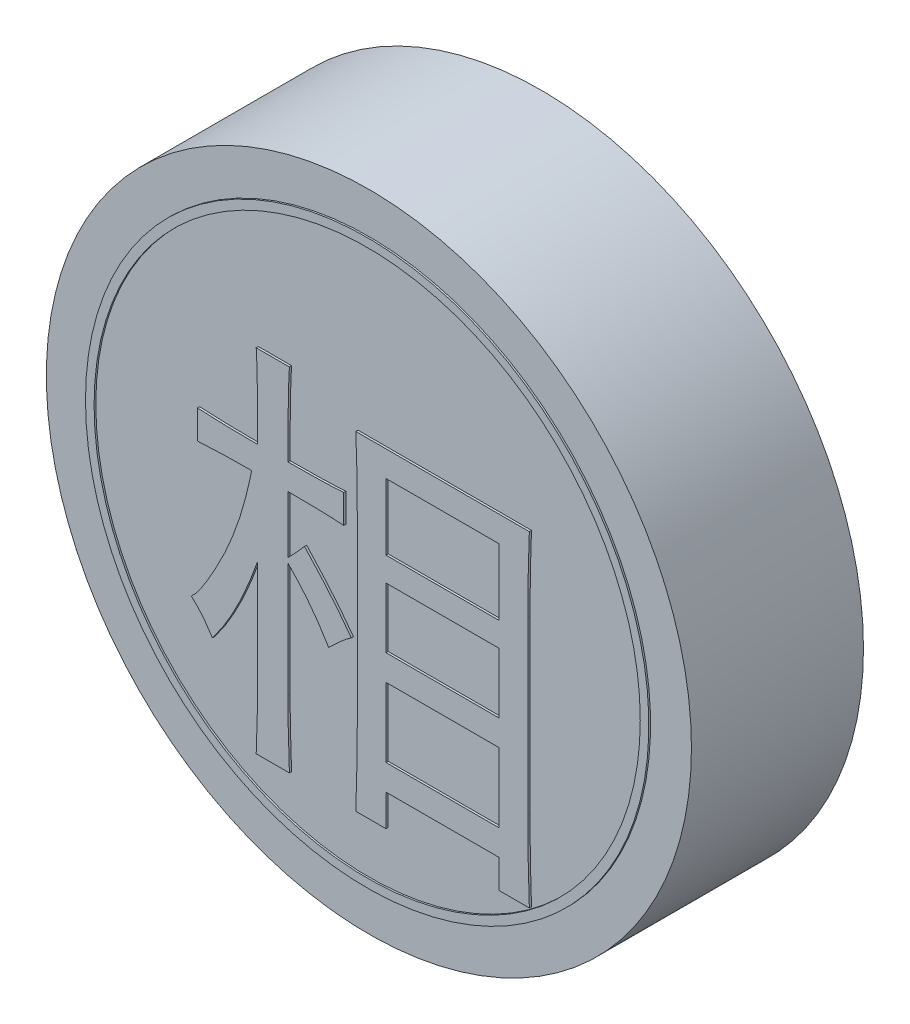
from build123d import *

# Parameters (mm, degrees)
SKETCH_1_R               = 15
DIAMETER30_HEIGHT8_DEPTH = 8
SKETCH_2_W               = 5.263157895
SKETCH_2_H               = 3.228070175
SKETCH_2_H_2             = 3.087719298
SKETCH_2_H_3             = 2.807017544
CHARACTER_DEPTH          = 0.1
SKETCH_3_R               = 13.1
SKETCH_3_R_2             = 12.7
INK_RING_DEPTH           = 0.08


with BuildPart() as part:
    # 草图1 → Diameter30_Height8 (new body)
    with BuildSketch(Plane.XY):
        Circle(SKETCH_1_R)
    extrude(amount=-DIAMETER30_HEIGHT8_DEPTH)

    # 草图2 → Character_相 (add)
    # profile 1 of 2: a face of its own
    with BuildSketch(Plane.XY):
        with BuildLine():
            add(Edge.make_bspline(
                [(7.561403509, 5.043859649), (7.55019112, 4.760584697), (7.527530744, 4.188082503), (7.508340227, 3.319863454), (7.49462205, 2.433550242), (7.492367, 1.83658782), (7.49122807, 1.535087719)],
                knots=[0, 0, 0, 0, 0.969283805, 1.958934606, 2.969145462, 4, 4, 4, 4], degree=3))
            Line((7.49122807, 1.535087719), (7.49122807, -6.394736842))
            add(Edge.make_bspline(
                [(7.49122807, -6.394736842), (7.494373274, -7.020306568), (7.500608133, -8.260397781), (7.541259106, -9.499836795), (7.561403509, -10.114035088)],
                knots=[0, 0, 0, 0, 1.008909215, 2, 2, 2, 2], degree=3))
            Line((7.561403509, -10.114035088), (6.157894737, -10.114035088))
            Line((6.157894737, -10.114035088), (6.157894737, -8.780701754))
            Line((6.157894737, -8.780701754), (0.894736842, -8.780701754))
            Line((0.894736842, -8.780701754), (0.894736842, -10.254385965))
            Line((0.894736842, -10.254385965), (-0.50877193, -10.254385965))
            add(Edge.make_bspline(
                [(-0.50877193, -10.254385965), (-0.497692205, -9.914790058), (-0.476326497, -9.259926631), (-0.456441705, -8.312053821), (-0.44245572, -7.435279895), (-0.439845263, -6.873840554), (-0.438596491, -6.605263158)],
                knots=[0, 0, 0, 0, 1.117081682, 2.154136505, 3.116988825, 4, 4, 4, 4], degree=3))
            Line((-0.438596491, -6.605263158), (-0.438596491, 1.605263158))
            add(Edge.make_bspline(
                [(-0.438596491, 1.605263158), (-0.439728026, 1.905030661), (-0.441958496, 2.495929231), (-0.45560045, 3.368382891), (-0.474798879, 4.214949159), (-0.497552487, 4.770115799), (-0.50877193, 5.043859649)],
                knots=[0, 0, 0, 0, 1.04583296, 2.06153501, 3.044173712, 4, 4, 4, 4], degree=3))
            Line((-0.50877193, 5.043859649), (7.561403509, 5.043859649))
        make_face()
        with Locations((3.52631579, -5.973684211)):
            Rectangle(SKETCH_2_W, SKETCH_2_H, mode=Mode.SUBTRACT)
        with Locations((3.52631579, 2.307017544)):
            Rectangle(SKETCH_2_W, SKETCH_2_H_2, mode=Mode.SUBTRACT)
        with Locations((3.52631579, -1.763157895)):
            Rectangle(SKETCH_2_W, SKETCH_2_H_3, mode=Mode.SUBTRACT)
    # profile 2 of 2: a face of its own
    with BuildSketch(Plane.XY):
        with BuildLine():
            add(Edge.make_bspline(
                [(-5.070175439, 2.236842105), (-5.069643134, 2.466430588), (-5.068622699, 2.906554508), (-5.075570455, 3.53725376), (-5.079714917, 4.10907054), (-5.087055031, 4.62111986), (-5.098673186, 5.0733128), (-5.106736303, 5.466792434), (-5.12325681, 5.801143721), (-5.135036136, 6.004664303), (-5.140350877, 6.096491228)],
                knots=[0, 0, 0, 0, 1.427178642, 2.735918853, 3.920795363, 4.981877593, 5.919216055, 6.732723881, 7.428214742, 8, 8, 8, 8], degree=3))
            Line((-5.140350877, 6.096491228), (-3.596491228, 6.096491228))
            add(Edge.make_bspline(
                [(-3.596491228, 6.096491228), (-3.601779492, 5.999464476), (-3.613344956, 5.787266417), (-3.630069425, 5.441663603), (-3.638095211, 5.041255673), (-3.649732329, 4.586464135), (-3.657106974, 4.077015184), (-3.661264203, 3.512129116), (-3.668208495, 2.892692888), (-3.667194182, 2.461232429), (-3.666666667, 2.236842105)],
                knots=[0, 0, 0, 0, 0.604055621, 1.321073082, 2.150740011, 3.093471638, 4.149178994, 5.317910599, 6.605121521, 8, 8, 8, 8], degree=3))
            add(Edge.make_bspline(
                [(-3.666666667, 2.236842105), (-3.530644111, 2.236328112), (-3.266384763, 2.235329545), (-2.88174296, 2.242348317), (-2.520442081, 2.246480446), (-2.183393026, 2.253960205), (-1.870707533, 2.265624871), (-1.582020196, 2.273807132), (-1.317912922, 2.290824228), (-1.149878443, 2.301807771), (-1.070175439, 2.307017544)],
                knots=[0, 0, 0, 0, 1.256536578, 2.441150545, 3.553740755, 4.59446206, 5.555405596, 6.444361595, 7.262121348, 8, 8, 8, 8], degree=3))
            Line((-1.070175439, 2.307017544), (-1.070175439, 0.973684211))
            add(Edge.make_bspline(
                [(-1.070175439, 0.973684211), (-1.144677854, 0.978928331), (-1.304031085, 0.990144981), (-1.556887974, 1.006935749), (-1.839513589, 1.015234756), (-2.149605268, 1.026721716), (-2.488385884, 1.034270902), (-2.855751381, 1.03840672), (-3.251657288, 1.045376401), (-3.525446035, 1.044375774), (-3.666666667, 1.043859649)],
                knots=[0, 0, 0, 0, 0.689951739, 1.475737907, 2.340680501, 3.301602752, 4.342301003, 5.470871417, 6.695471813, 8, 8, 8, 8], degree=3))
            Line((-3.666666667, 1.043859649), (-3.666666667, -1.622807018))
            add(Edge.make_bspline(
                [(-3.666666667, -1.622807018), (-3.606636203, -1.561535904), (-3.48182972, -1.434150045), (-3.293392102, -1.23182095), (-3.094864807, -1.013455465), (-2.962807273, -0.859869327), (-2.894736842, -0.780701754)],
                knots=[0, 0, 0, 0, 0.900819035, 1.872850031, 2.903538413, 4, 4, 4, 4], degree=3))
            add(Edge.make_bspline(
                [(-2.894736842, -0.780701754), (-2.689573637, -1.00021337), (-2.288105654, -1.429758644), (-1.724253911, -2.085214095), (-1.199061827, -2.727559357), (-0.877018772, -3.163628299), (-0.719298246, -3.377192982)],
                knots=[0, 0, 0, 0, 1.063555414, 2.081189198, 3.060262768, 4, 4, 4, 4], degree=3))
            add(Edge.make_bspline(
                [(-0.719298246, -3.377192982), (-0.794679109, -3.429771468), (-0.958911081, -3.544323996), (-1.205171009, -3.756414434), (-1.484543132, -4.003739185), (-1.672408418, -4.190524428), (-1.771929825, -4.289473684)],
                knots=[0, 0, 0, 0, 0.790186824, 1.721576733, 2.793008042, 4, 4, 4, 4], degree=3))
            add(Edge.make_bspline(
                [(-1.771929825, -4.289473684), (-1.904998341, -4.0700807), (-2.172035646, -3.629810433), (-2.627101337, -3.003052442), (-3.120200979, -2.3973547), (-3.483629338, -2.022250893), (-3.666666667, -1.833333333)],
                knots=[0, 0, 0, 0, 0.989574309, 1.98584356, 2.985588755, 4, 4, 4, 4], degree=3))
            Line((-3.666666667, -1.833333333), (-3.666666667, -7.166666667))
            add(Edge.make_bspline(
                [(-3.666666667, -7.166666667), (-3.66710265, -7.269767462), (-3.668003985, -7.48291384), (-3.66072287, -7.813831844), (-3.656774838, -8.166472041), (-3.648756785, -8.54161481), (-3.637317912, -8.938358747), (-3.628857904, -9.357787252), (-3.611274705, -9.798652569), (-3.601493913, -10.100167122), (-3.596491228, -10.254385965)],
                knots=[0, 0, 0, 0, 0.801096895, 1.65615505, 2.571793352, 3.541398262, 4.571731919, 5.655903347, 6.80104005, 8, 8, 8, 8], degree=3))
            Line((-3.596491228, -10.254385965), (-5.140350877, -10.254385965))
            add(Edge.make_bspline(
                [(-5.140350877, -10.254385965), (-5.135369022, -10.10016635), (-5.125684865, -9.80038102), (-5.107972861, -9.362986873), (-5.099566341, -8.949620037), (-5.088128806, -8.560674404), (-5.080093207, -8.195928707), (-5.076127742, -7.855416847), (-5.068855811, -7.538361954), (-5.069746959, -7.334744801), (-5.070175439, -7.236842105)],
                knots=[0, 0, 0, 0, 1.22682853, 2.384814657, 3.480414063, 4.514038807, 5.478633795, 6.38111711, 7.221612736, 8, 8, 8, 8], degree=3))
            Line((-5.070175439, -7.236842105), (-5.070175439, -2.464912281))
            add(Edge.make_bspline(
                [(-5.070175439, -2.464912281), (-5.145846519, -2.675980137), (-5.294332566, -3.090149346), (-5.536827031, -3.689408015), (-5.785768752, -4.257890313), (-6.045384746, -4.792645481), (-6.312844256, -5.294903161), (-6.587960306, -5.764116531), (-6.873615691, -6.199513832), (-7.076236773, -6.471903257), (-7.175438596, -6.605263158)],
                knots=[0, 0, 0, 0, 1.153721074, 2.263896326, 3.325849438, 4.34673122, 5.322030602, 6.253316748, 7.144836456, 8, 8, 8, 8], degree=3))
            add(Edge.make_bspline(
                [(-7.175438596, -6.605263158), (-7.255029914, -6.482647166), (-7.407975598, -6.247023641), (-7.657596365, -5.928969858), (-7.897823334, -5.645524257), (-8.073840549, -5.487664221), (-8.157894737, -5.412280702)],
                knots=[0, 0, 0, 0, 1.130515109, 2.172440566, 3.127278412, 4, 4, 4, 4], degree=3))
            add(Edge.make_bspline(
                [(-8.157894737, -5.412280702), (-8.113720781, -5.370641152), (-8.01581978, -5.278357058), (-7.875116797, -5.106371966), (-7.717691149, -4.894771662), (-7.55214221, -4.637411783), (-7.368626266, -4.340225536), (-7.17523642, -3.999537296), (-6.966943261, -3.616722912), (-6.748324508, -3.195711401), (-6.527564492, -2.742508267), (-6.321130463, -2.262276924), (-6.126625974, -1.76162537), (-5.940007338, -1.243020266), (-5.775804486, -0.699655792), (-5.619811727, -0.137450112), (-5.476041057, 0.445727539), (-5.392993233, 0.842595842), (-5.350877193, 1.043859649)],
                knots=[0, 0, 0, 0, 0.40920384, 0.906902363, 1.496106211, 2.188358286, 2.970301714, 3.852632424, 4.830874076, 5.910586812, 7.053030269, 8.231162496, 9.436019769, 10.676532886, 11.948579996, 13.264574909, 14.612783986, 16, 16, 16, 16], degree=3))
            add(Edge.make_bspline(
                [(-5.350877193, 1.043859649), (-5.59606702, 1.042803509), (-6.063956973, 1.040788102), (-6.730227869, 1.027390075), (-7.327421009, 1.009098406), (-7.701367224, 0.985010229), (-7.877192982, 0.973684211)],
                knots=[0, 0, 0, 0, 1.163979785, 2.221195127, 3.163623796, 4, 4, 4, 4], degree=3))
            Line((-7.877192982, 0.973684211), (-7.877192982, 2.307017544))
            add(Edge.make_bspline(
                [(-7.877192982, 2.307017544), (-7.660637158, 2.295769666), (-7.216421348, 2.272697163), (-6.531817674, 2.253723458), (-5.812703734, 2.240131437), (-5.321428092, 2.237955131), (-5.070175439, 2.236842105)],
                knots=[0, 0, 0, 0, 0.926596032, 1.900704393, 2.926359164, 4, 4, 4, 4], degree=3))
        make_face()
    extrude(amount=CHARACTER_DEPTH)

    # 草图3 → Ink_ring (add)
    with BuildSketch(Plane.XY):
        with Locations(Location((0, 0, 0), (0, 0, 180))):
            Circle(SKETCH_3_R)
        with Locations(Location((0, 0, 0), (0, 0, 180))):
            Circle(SKETCH_3_R_2, mode=Mode.SUBTRACT)
    extrude(amount=INK_RING_DEPTH)


solid = part.part
